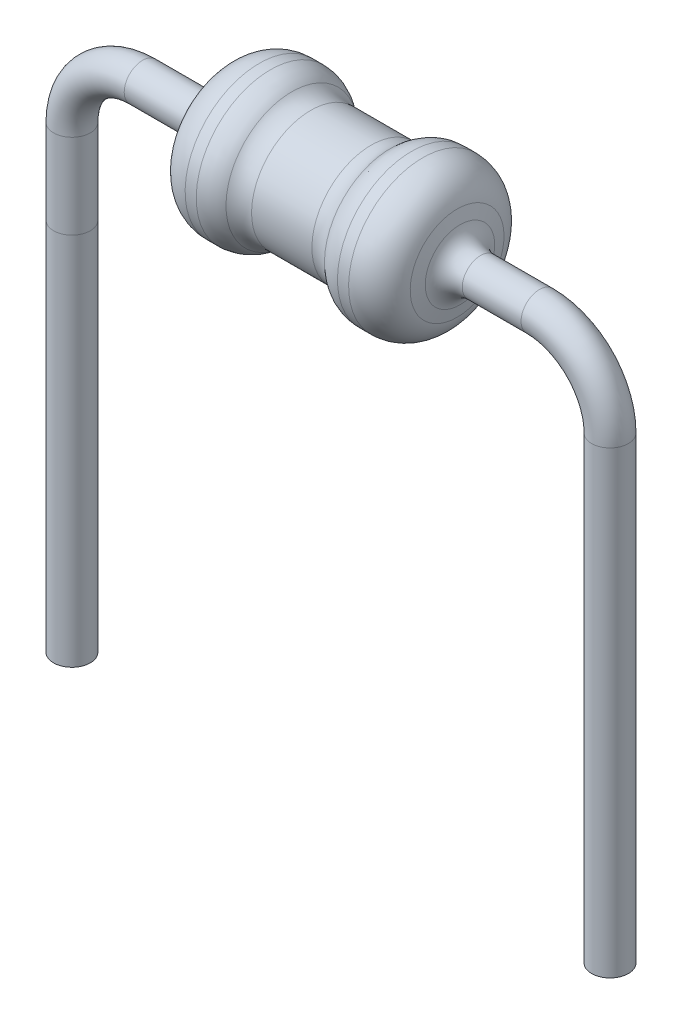
from build123d import *

# Parameters (mm, degrees)
SKETCH1_R             = 0.26
BOSS_EXTRUDE1_DEPTH   = 5.3
BOSS_EXTRUDE1_2_DEPTH = 5.3
SKETCH4_R             = 0.26
FILLET2_R             = 0.3


with BuildPart() as part:
    # Sketch1 → Boss-Extrude1 (new body)
    with BuildSketch(Plane(origin=(0, 0, 0), x_dir=(1, 0, 0), z_dir=(0, 1, 0))):
        with Locations(Location((-3.81, 0, 0), (0, 0, 270))):
            Circle(SKETCH1_R)
    extrude(amount=BOSS_EXTRUDE1_DEPTH)


with BuildPart() as body_2:
    # Sketch1 → Boss-Extrude1 2 (new body)
    with BuildSketch(Plane(origin=(0, 0, 0), x_dir=(1, 0, 0), z_dir=(0, 1, 0))):
        with Locations(Location((3.81, 0, 0), (0, 0, 90))):
            Circle(SKETCH1_R)
    extrude(amount=BOSS_EXTRUDE1_2_DEPTH)



with BuildPart() as body_3:
    # Sketch2 → Revolve1 (revolve)
    with BuildSketch(Plane.XY, mode=Mode.PRIVATE) as revolve1_sk:
        with BuildLine():
            Line((-1.644218888, 8.164175537), (-1.8, 7.5))
            Line((-1.8, 7.5), (1.8, 7.5))
            Line((1.8, 7.5), (1.644218888, 8.164175537))
            ThreePointArc((1.644218888, 8.164175537), (1.46800331, 8.441846761), (1.15742946, 8.55))
            Line((1.15742946, 8.55), (1, 8.55))
            ThreePointArc((1, 8.55), (0.837396621, 8.519281515), (0.697206266, 8.431360251))
            ThreePointArc((0.697206266, 8.431360251), (0.571959777, 8.356643172), (0.427167283, 8.339194432))
            Line((0.427167283, 8.339194432), (-0.427167283, 8.339194432))
            ThreePointArc((-0.427167283, 8.339194432), (-0.571959777, 8.356643172), (-0.697206266, 8.431360251))
            ThreePointArc((-0.697206266, 8.431360251), (-0.837396621, 8.519281515), (-1, 8.55))
            Line((-1, 8.55), (-1.15742946, 8.55))
            ThreePointArc((-1.15742946, 8.55), (-1.46800331, 8.441846761), (-1.644218888, 8.164175537))
        make_face()
    revolve(revolve1_sk.sketch.rotate(Axis((-1.8, 7.5, 0), (1, 0, 0)), 180), axis=Axis((-1.8, 7.5, 0), (1, 0, 0)))


with BuildPart() as body_2_1:
    add(body_2.part)

    add(body_3.part)  # Sweep1 merges body 3
    # Sweep1: sweep along a path in Sketch3
    with BuildLine(Plane.XY) as sweep1_path:
        Line((1.5679668, 7.5), (2.81, 7.5))
        ThreePointArc((2.81, 7.5), (3.517106781, 7.207106781), (3.81, 6.5))
        Line((3.81, 6.5), (3.81, 5.3))
    # Sketch4 → Sweep1 (sweep)
    with BuildSketch(Plane(origin=(0, 5.3, 0), x_dir=(1, 0, 0), z_dir=(0, 1, 0))):
        with Locations((3.81, 0)):
            Circle(SKETCH4_R)
    sweep1 = sweep(path=sweep1_path.line)

    # Mirror1: Sweep1 across plane
    add(sweep1.mirror(Plane(origin=(0, 0, 0), x_dir=(0, 0, 1), z_dir=(1, 0, 0))))

    # Fillet2
    fillet2_edges = [body_2_1.edges().sort_by_distance(p)[0] for p in [
        (1.739017493, 7.5, -0.26),
        (-1.739017493, 7.5, -0.26),
    ]]
    fillet(fillet2_edges, radius=FILLET2_R)


solid = Compound([part.part, body_2_1.part])
